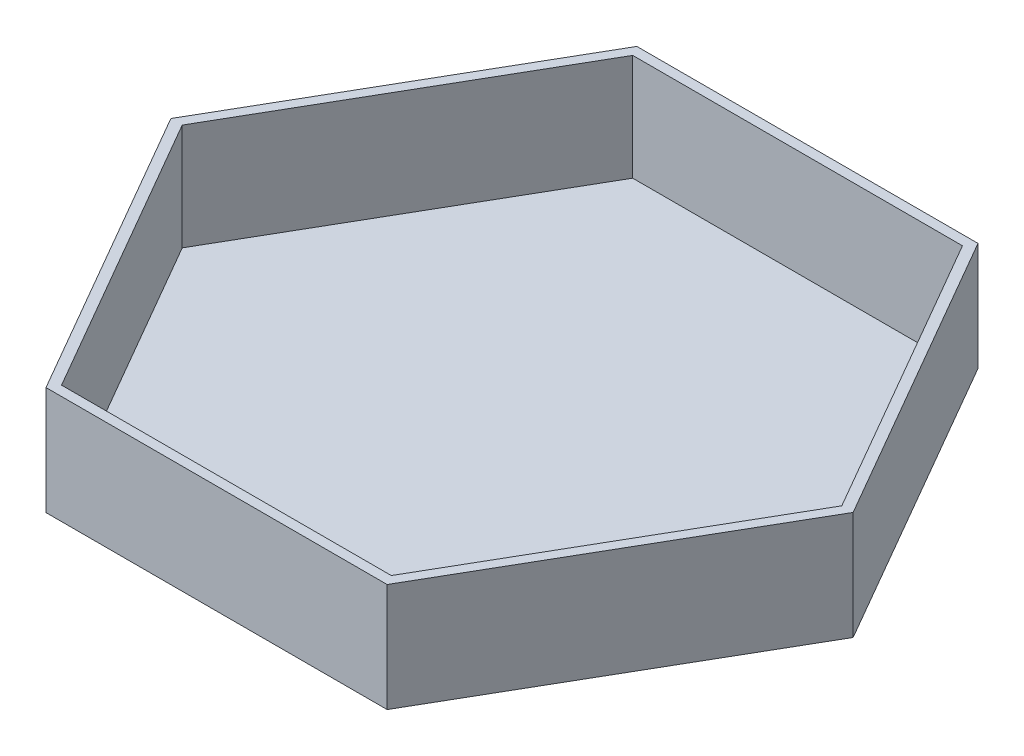
from build123d import *

# Parameters (mm, degrees)
BOSS_EXTRUDE1_DEPTH      = 55
SHELL1_T                 = -5
SHELL1_THICKNESS_2_DEPTH = 4


with BuildPart() as part:
    # Sketch1 → Boss-Extrude1 (new body)
    with BuildSketch(Plane(origin=(0, 0, 0), x_dir=(1, 0, 0), z_dir=(0, 1, 0))):
        Polygon((173.205080757, 0), (86.602540378, 150), (-86.602540378, 150), (-173.205080757, 0), (-86.602540378, -150), (86.602540378, -150), align=None)
    extrude(amount=BOSS_EXTRUDE1_DEPTH)

    # Shell1
    shell1_openings = [part.faces().sort_by_distance(p)[0] for p in [
        (0, 55, 0),
    ]]
    offset(amount=SHELL1_T, openings=shell1_openings, kind=Kind.INTERSECTION)

    # Shell1 thickness 2 face (on inner face of the shell) → Shell1 thickness 2 (cut)
    with BuildSketch(Plane(origin=(0, 5, 0), x_dir=(0, 0, -1), z_dir=(0, -1, 0))):
        Polygon((-145, 83.715789032), (0, 167.431578065), (145, 83.715789032), (145, -83.715789032), (0, -167.431578065), (-145, -83.715789032), align=None)
    extrude(amount=SHELL1_THICKNESS_2_DEPTH, mode=Mode.SUBTRACT)


solid = part.part
